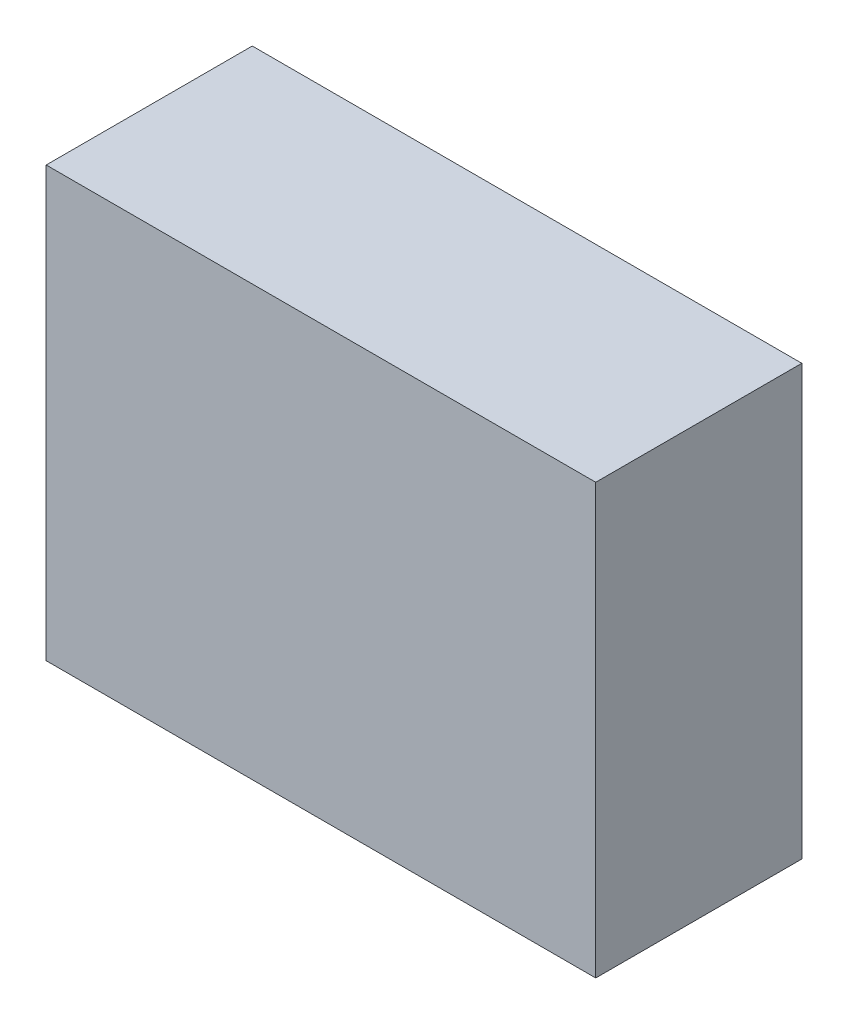
from build123d import *

# Parameters (mm, degrees)
SKETCH1_W      = 48
SKETCH1_H      = 37.5
ENVELOPE_DEPTH = 18


with BuildPart() as part:
    # Sketch1 → Envelope (new body)
    with BuildSketch(Plane.XY):
        Rectangle(SKETCH1_W, SKETCH1_H)
    extrude(amount=ENVELOPE_DEPTH)


solid = part.part
